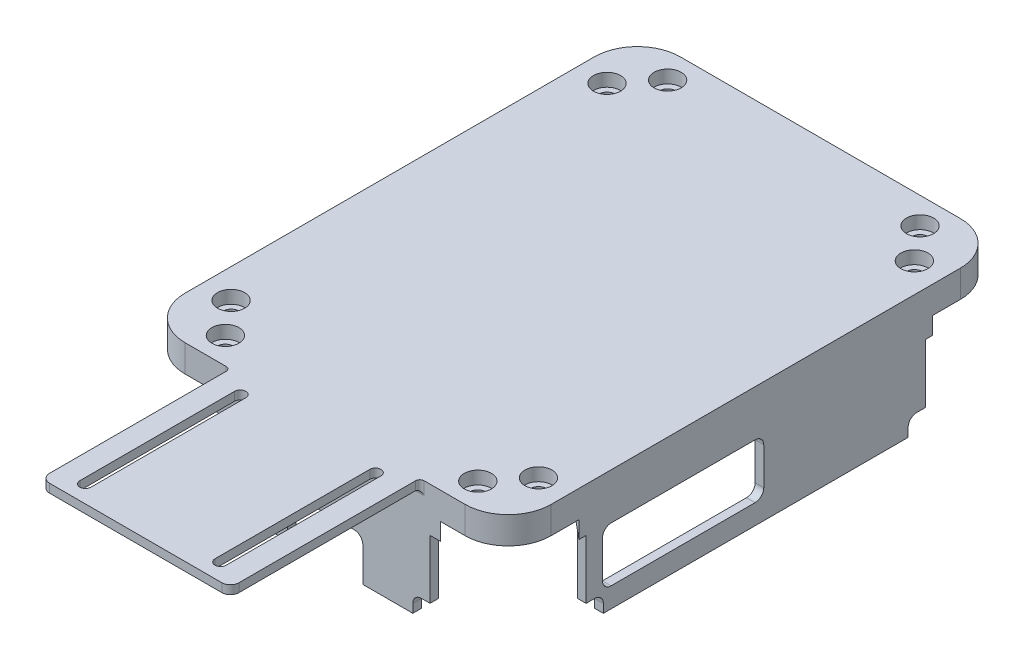
from build123d import *

# Parameters (mm, degrees)
SKETCH1_W                = 107.95
SKETCH1_H                = 146.05
BOSS_EXTRUDE1_DEPTH      = 2.54
SKETCH13_W               = 25.4
SKETCH13_H               = 25.4
BOSS_EXTRUDE4_DEPTH      = 13.08354
SKETCH2_R                = 3.302
CUT_EXTRUDE1_DEPTH       = 92.744919581
FILLET1_R                = 12.7
CUT_EXTRUDE13_DEPTH      = 5.08
SKETCH15_R               = 5.08
BOSS_EXTRUDE5_DEPTH      = 5.46354
SKETCH23_R               = 2.25
CUT_EXTRUDE14_DEPTH      = 92.159244745
SKETCH24_R               = 4
CUT_EXTRUDE15_DEPTH      = 3.81
MIRROR2_COPY_1_SKETCH_R  = 2.25
MIRROR2_COPY_1_DEPTH     = 92.159244745
MIRROR2_COPY_2_SKETCH_R  = 4
MIRROR2_COPY_2_DEPTH     = 3.81
FILLET3_R                = 12.7
FILLET4_R                = 1.016
SKETCH27_W               = 61.892863874
SKETCH27_H               = 2.54
SKETCH27_W_2             = 2.54
SKETCH27_H_2             = 100.05065864
BOSS_EXTRUDE6_DEPTH      = 32.98825
CUT_EXTRUDE16_DEPTH      = 41.656
CUT_EXTRUDE17_DEPTH      = 136.085564266
CUT_EXTRUDE18_DEPTH      = 160.706479747
CUT_EXTRUDE19_REACH      = 161.706
SKETCH31_W               = 22.225
SKETCH31_H               = 12.7
FILLET5_R                = 2.54
BOSS_EXTRUDE7_DEPTH      = 2.54
FILLET6_R                = 1.27
FILLET7_R                = 1.27
CUT_EXTRUDE20_DEPTH      = 9.398
CUT_EXTRUDE20_DEPTH_BACK = 128.27


with BuildPart() as part:
    # Sketch1 → Boss-Extrude1 (new body)
    with BuildSketch(Plane(origin=(0, 0, 0), x_dir=(1, 0, 0), z_dir=(0, 1, 0))):
        Rectangle(SKETCH1_W, SKETCH1_H)
    extrude(amount=-BOSS_EXTRUDE1_DEPTH)

    # Sketch13 → Boss-Extrude4 (add)
    with BuildSketch(Plane(origin=(0, 0, 0), x_dir=(1, 0, 0), z_dir=(0, 1, 0))):
        with Locations((41.275, -60.325)):
            Rectangle(SKETCH13_W, SKETCH13_H)
        with Locations((-41.275, -60.325)):
            Rectangle(SKETCH13_W, SKETCH13_H)
        with Locations((-41.275, 60.325)):
            Rectangle(SKETCH13_W, SKETCH13_H)
        with Locations((41.275, 60.325)):
            Rectangle(SKETCH13_W, SKETCH13_H)
    extrude(amount=-BOSS_EXTRUDE4_DEPTH)

    # Sketch2 → Cut-Extrude1 (cut, through all)
    with BuildSketch(Plane(origin=(0, 0, 0), x_dir=(1, 0, 0), z_dir=(0, 1, 0))):
        with Locations(Location((45.326413441, 55.435363088, 0), (0, 0, 90))):
            Circle(SKETCH2_R)
        with Locations(Location((37.223586559, 65.214636912, 0), (0, 0, 90))):
            Circle(SKETCH2_R)
        with Locations(Location((45.326413441, -55.435363088, 0), (0, 0, 270))):
            Circle(SKETCH2_R)
        with Locations(Location((37.223586559, -65.214636912, 0), (0, 0, 270))):
            Circle(SKETCH2_R)
        with Locations(Location((-37.223586559, 65.214636912, 0), (0, 0, 270))):
            Circle(SKETCH2_R)
        with Locations(Location((-45.326413441, 55.435363088, 0), (0, 0, 270))):
            Circle(SKETCH2_R)
        with Locations(Location((-45.326413441, -55.435363088, 0), (0, 0, 90))):
            Circle(SKETCH2_R)
        with Locations(Location((-37.223586559, -65.214636912, 0), (0, 0, 90))):
            Circle(SKETCH2_R)
    extrude(amount=-CUT_EXTRUDE1_DEPTH, mode=Mode.SUBTRACT)

    # Fillet1
    fillet1_edges = [part.edges().sort_by_distance(p)[0] for p in [
        (53.975, -6.54177, 73.025),
        (-53.975, -6.54177, 73.025),
        (-53.975, -6.54177, -73.025),
        (53.975, -6.54177, -73.025),
    ]]
    fillet(fillet1_edges, radius=FILLET1_R)

    # Sketch14 → Cut-Extrude13 (cut)
    with BuildSketch(Plane.XZ.offset(13.08354)):
        Polygon((24.741796458, -27.908103527), (6.35, -50.105099252), (137.013329857, -158.369001134), (155.405126315, -136.172005409), align=None)
        Polygon((-24.741796458, -27.908103527), (-6.35, -50.105099252), (-137.013329857, -158.369001134), (-155.405126315, -136.172005409), align=None)
        Polygon((-155.405126315, 136.172005409), (-24.741796458, 27.908103527), (-6.35, 50.105099252), (-137.013329857, 158.369001134), align=None)
        Polygon((24.741796458, 27.908103527), (6.35, 50.105099252), (137.013329857, 158.369001134), (155.405126315, 136.172005409), align=None)
    extrude(amount=-CUT_EXTRUDE13_DEPTH, mode=Mode.SUBTRACT)

    # Sketch15 → Boss-Extrude5 (add)
    with BuildSketch(Plane(origin=(0, 0, 0), x_dir=(1, 0, 0), z_dir=(0, 1, 0))):
        with Locations((-45.326413441, 55.435363088)):
            Circle(SKETCH15_R)
        with Locations((45.326413441, 55.435363088)):
            Circle(SKETCH15_R)
        with Locations((37.223586559, 65.214636912)):
            Circle(SKETCH15_R)
        with Locations((45.326413441, -55.435363088)):
            Circle(SKETCH15_R)
        with Locations((37.223586559, -65.214636912)):
            Circle(SKETCH15_R)
        with Locations((-37.223586559, -65.214636912)):
            Circle(SKETCH15_R)
        with Locations((-37.223586559, 65.214636912)):
            Circle(SKETCH15_R)
        with Locations((-45.326413441, -55.435363088)):
            Circle(SKETCH15_R)
    extrude(amount=-BOSS_EXTRUDE5_DEPTH)

    # Sketch23 → Cut-Extrude14 (cut, through all)
    with BuildSketch(Plane.XZ.offset(8.00354)):
        with Locations(Location((-45.326413441, -55.435363088, 0), (0, 0, 270))):
            Circle(SKETCH23_R)
        with Locations(Location((-37.223586559, -65.214636912, 0), (0, 0, 270))):
            Circle(SKETCH23_R)
    cut_extrude14 = extrude(amount=-CUT_EXTRUDE14_DEPTH, mode=Mode.SUBTRACT)

    # Sketch24 → Cut-Extrude15 (cut)
    with BuildSketch(Plane(origin=(0, 0, 0), x_dir=(1, 0, 0), z_dir=(0, 1, 0))):
        with Locations(Location((-45.326413441, 55.435363088, 0), (0, 0, 270))):
            Circle(SKETCH24_R)
        with Locations(Location((-37.223586559, 65.214636912, 0), (0, 0, 270))):
            Circle(SKETCH24_R)
    cut_extrude15 = extrude(amount=-CUT_EXTRUDE15_DEPTH, mode=Mode.SUBTRACT)

    # Mirror1: Cut-Extrude14, Cut-Extrude15 across plane
    add(cut_extrude14.mirror(Plane.XY), mode=Mode.SUBTRACT)
    add(cut_extrude15.mirror(Plane.XY), mode=Mode.SUBTRACT)

    # Mirror2: Cut-Extrude14, Cut-Extrude15 across plane
    add(cut_extrude14.mirror(Plane(origin=(0, 0, 0), x_dir=(0, 0, 1), z_dir=(1, 0, 0))), mode=Mode.SUBTRACT)
    add(cut_extrude15.mirror(Plane(origin=(0, 0, 0), x_dir=(0, 0, 1), z_dir=(1, 0, 0))), mode=Mode.SUBTRACT)

    # Mirror2 copy 1 sketch → Mirror2 copy 1 (cut, through all)
    with BuildSketch(Plane(origin=(0, -8.00354, 0), x_dir=(-1, 0, 0), z_dir=(0, -1, 0))):
        with Locations(Location((-45.326413441, -55.435363088, 0), (0, 0, 270))):
            Circle(MIRROR2_COPY_1_SKETCH_R)
        with Locations(Location((-37.223586559, -65.214636912, 0), (0, 0, 270))):
            Circle(MIRROR2_COPY_1_SKETCH_R)
    extrude(amount=-MIRROR2_COPY_1_DEPTH, mode=Mode.SUBTRACT)

    # Mirror2 copy 2 sketch → Mirror2 copy 2 (cut)
    with BuildSketch(Plane(origin=(0, 0, 0), x_dir=(-1, 0, 0), z_dir=(0, 1, 0))):
        with Locations(Location((-45.326413441, 55.435363088, 0), (0, 0, 270))):
            Circle(MIRROR2_COPY_2_SKETCH_R)
        with Locations(Location((-37.223586559, 65.214636912, 0), (0, 0, 270))):
            Circle(MIRROR2_COPY_2_SKETCH_R)
    extrude(amount=-MIRROR2_COPY_2_DEPTH, mode=Mode.SUBTRACT)

    # Fillet3
    fillet3_edges = [part.edges().sort_by_distance(p)[0] for p in [
        (28.575, -5.27177, -47.625),
        (-28.575, -5.27177, -47.625),
        (-28.575, -5.27177, 47.625),
        (28.575, -5.27177, 47.625),
    ]]
    fillet(fillet3_edges, radius=FILLET3_R)

    # Fillet4
    fillet4_edges = [part.edges().sort_by_distance(p)[0] for p in [
        (45.326413441, -8.00354, -52.133363088),
        (37.223586559, -8.00354, -61.912636912),
        (-45.326413441, -8.00354, -58.737363088),
        (-37.223586559, -8.00354, -68.516636912),
        (-45.326413441, -8.00354, 58.737363088),
        (-37.223586559, -8.00354, 68.516636912),
        (37.223586559, -8.00354, 61.912636912),
        (45.326413441, -8.00354, 52.133363088),
    ]]
    fillet(fillet4_edges, radius=FILLET4_R)

    # Sketch27 → Boss-Extrude6 (add)
    with BuildSketch(Plane.XZ.offset(2.54)):
        with Locations((0, -71.755)):
            Rectangle(SKETCH27_W, SKETCH27_H)
        with Locations((0, 71.755)):
            Rectangle(SKETCH27_W, SKETCH27_H)
        with Locations((52.705, 0)):
            Rectangle(SKETCH27_W_2, SKETCH27_H_2)
        with Locations((-52.705, 0)):
            Rectangle(SKETCH27_W_2, SKETCH27_H_2)
    extrude(amount=BOSS_EXTRUDE6_DEPTH)

    # Sketch28 → Cut-Extrude16 (cut)
    with BuildSketch(Plane(origin=(0, 0, -73.025), x_dir=(-1, 0, 0), z_dir=(0, 0, -1))):
        with BuildLine():
            Line((-17.526, -35.52825), (17.526, -35.52825))
            Line((17.526, -35.52825), (29.591, -35.52825))
            Line((29.591, -35.52825), (29.591, -32.98825))
            ThreePointArc((29.591, -32.98825), (28.847051224, -31.192198776), (27.051, -30.44825))
            Line((27.051, -30.44825), (19.431, -30.44825))
            ThreePointArc((19.431, -30.44825), (17.634948776, -29.704301224), (16.891, -27.90825))
            Line((16.891, -27.90825), (16.891, -20.60575))
            ThreePointArc((16.891, -20.60575), (16.147051224, -18.809698776), (14.351, -18.06575))
            Line((14.351, -18.06575), (-14.351, -18.06575))
            ThreePointArc((-14.351, -18.06575), (-16.147051224, -18.809698776), (-16.891, -20.60575))
            Line((-16.891, -20.60575), (-16.891, -27.90825))
            ThreePointArc((-16.891, -27.90825), (-17.634948776, -29.704301224), (-19.431, -30.44825))
            Line((-19.431, -30.44825), (-27.051, -30.44825))
            ThreePointArc((-27.051, -30.44825), (-28.847051224, -31.192198776), (-29.591, -32.98825))
            Line((-29.591, -32.98825), (-29.591, -35.52825))
            Line((-29.591, -35.52825), (-17.526, -35.52825))
        make_face()
    extrude(amount=-CUT_EXTRUDE16_DEPTH, mode=Mode.SUBTRACT)

    # Sketch29 → Cut-Extrude17 (cut, through all)
    with BuildSketch(Plane.ZY.offset(53.975)):
        with BuildLine():
            Line((-50.02532932, -35.52825), (-44.94532932, -35.52825))
            Line((-44.94532932, -35.52825), (-44.94532932, -32.98825))
            ThreePointArc((-44.94532932, -32.98825), (-45.689278095, -31.192198776), (-47.48532932, -30.44825))
            Line((-47.48532932, -30.44825), (-50.02532932, -30.44825))
            Line((-50.02532932, -30.44825), (-50.02532932, -35.52825))
        make_face()
        with BuildLine():
            Line((44.94532932, -35.52825), (44.94532932, -32.98825))
            ThreePointArc((44.94532932, -32.98825), (45.689278095, -31.192198776), (47.48532932, -30.44825))
            Line((47.48532932, -30.44825), (50.02532932, -30.44825))
            Line((50.02532932, -30.44825), (50.02532932, -35.52825))
            Line((50.02532932, -35.52825), (44.94532932, -35.52825))
        make_face()
    extrude(amount=-CUT_EXTRUDE17_DEPTH, mode=Mode.SUBTRACT)

    # Sketch30 → Cut-Extrude18 (cut, through all)
    with BuildSketch(Plane.XY.offset(73.025)):
        with BuildLine():
            Line((-30.946431937, -35.52825), (-25.866431937, -35.52825))
            Line((-25.866431937, -35.52825), (-25.866431937, -32.98825))
            ThreePointArc((-25.866431937, -32.98825), (-26.610380713, -31.192198776), (-28.406431937, -30.44825))
            Line((-28.406431937, -30.44825), (-30.946431937, -30.44825))
            Line((-30.946431937, -30.44825), (-30.946431937, -35.52825))
        make_face()
        with BuildLine():
            Line((25.866431937, -35.52825), (25.866431937, -32.98825))
            ThreePointArc((25.866431937, -32.98825), (26.610380713, -31.192198776), (28.406431937, -30.44825))
            Line((28.406431937, -30.44825), (30.946431937, -30.44825))
            Line((30.946431937, -30.44825), (30.946431937, -35.52825))
            Line((30.946431937, -35.52825), (25.866431937, -35.52825))
        make_face()
    extrude(amount=-CUT_EXTRUDE18_DEPTH, mode=Mode.SUBTRACT)

    # Sketch31 → Cut-Extrude19 (cut, up to next)
    with BuildSketch(Plane.XY.offset(73.025), mode=Mode.PRIVATE) as cut_extrude19_sk1:
        with Locations((0, -29.17825)):
            Rectangle(SKETCH31_W, SKETCH31_H)
    cut_extrude19_tool1 = extrude(cut_extrude19_sk1.sketch, amount=-CUT_EXTRUDE19_REACH, mode=Mode.PRIVATE) & part.part
    add(cut_extrude19_tool1.solids().sort_by_distance((0, -29.17825, 73.025))[0], mode=Mode.SUBTRACT)

    # Fillet5
    fillet5_edges = [part.edges().sort_by_distance(p)[0] for p in [
        (-11.1125, -22.82825, 71.755),
        (11.1125, -22.82825, 71.755),
    ]]
    fillet(fillet5_edges, radius=FILLET5_R)

    # Sketch33 → Boss-Extrude7 (add)
    with BuildSketch(Plane(origin=(0, 0, 0), x_dir=(1, 0, 0), z_dir=(0, 1, 0))):
        with BuildLine():
            Line((-27.94, -73.025), (0, -73.025))
            Line((0, -73.025), (27.94, -73.025))
            Line((27.94, -73.025), (27.94, -100.965))
            Line((27.94, -100.965), (27.94, -126.365))
            ThreePointArc((27.94, -126.365), (27.196051224, -128.161051224), (25.4, -128.905))
            Line((25.4, -128.905), (0, -128.905))
            Line((0, -128.905), (-25.4, -128.905))
            ThreePointArc((-25.4, -128.905), (-27.196051224, -128.161051224), (-27.94, -126.365))
            Line((-27.94, -126.365), (-27.94, -100.965))
            Line((-27.94, -100.965), (-27.94, -73.025))
        make_face()
        with BuildLine():
            Line((-18.288, -78.138531527), (-18.288, -123.791468473))
            ThreePointArc((-18.288, -123.791468473), (-19.939, -125.442468473), (-21.59, -123.791468473))
            Line((-21.59, -123.791468473), (-21.59, -78.138531527))
            ThreePointArc((-21.59, -78.138531527), (-19.939, -76.487531527), (-18.288, -78.138531527))
        make_face(mode=Mode.SUBTRACT)
        with BuildLine():
            Line((18.288, -78.138531527), (18.288, -123.791468473))
            ThreePointArc((18.288, -123.791468473), (19.939, -125.442468473), (21.59, -123.791468473))
            Line((21.59, -123.791468473), (21.59, -78.138531527))
            ThreePointArc((21.59, -78.138531527), (19.939, -76.487531527), (18.288, -78.138531527))
        make_face(mode=Mode.SUBTRACT)
    extrude(amount=-BOSS_EXTRUDE7_DEPTH)

    # Fillet6
    fillet6_edges = [part.edges().sort_by_distance(p)[0] for p in [
        (0, -2.54, 73.025),
    ]]
    fillet(fillet6_edges, radius=FILLET6_R)

    # Fillet7
    fillet7_edges = [part.edges().sort_by_distance(p)[0] for p in [
        (27.94, -1.905, 73.025),
        (-27.94, -1.905, 73.025),
    ]]
    fillet(fillet7_edges, radius=FILLET7_R)

    # Sketch34 → Cut-Extrude20 (cut, two sides: drawn at the far end of the back side and taken through both)
    with BuildSketch(Plane.ZY.offset(53.975).offset(-CUT_EXTRUDE20_DEPTH_BACK)):
        with BuildLine():
            Line((0.176300373, -13.586998356), (42.651664404, -13.586998356))
            ThreePointArc((42.651664404, -13.586998356), (44.447715628, -14.330947132), (45.191664404, -16.126998356))
            Line((45.191664404, -16.126998356), (45.191664404, -27.091200876))
            ThreePointArc((45.191664404, -27.091200876), (44.447715628, -28.8872521), (42.651664404, -29.631200876))
            Line((42.651664404, -29.631200876), (0.176300373, -29.631200876))
            ThreePointArc((0.176300373, -29.631200876), (-1.619750851, -28.8872521), (-2.363699627, -27.091200876))
            Line((-2.363699627, -27.091200876), (-2.363699627, -16.126998356))
            ThreePointArc((-2.363699627, -16.126998356), (-1.619750851, -14.330947132), (0.176300373, -13.586998356))
        make_face()
    extrude(amount=CUT_EXTRUDE20_DEPTH + CUT_EXTRUDE20_DEPTH_BACK, mode=Mode.SUBTRACT)


solid = part.part
